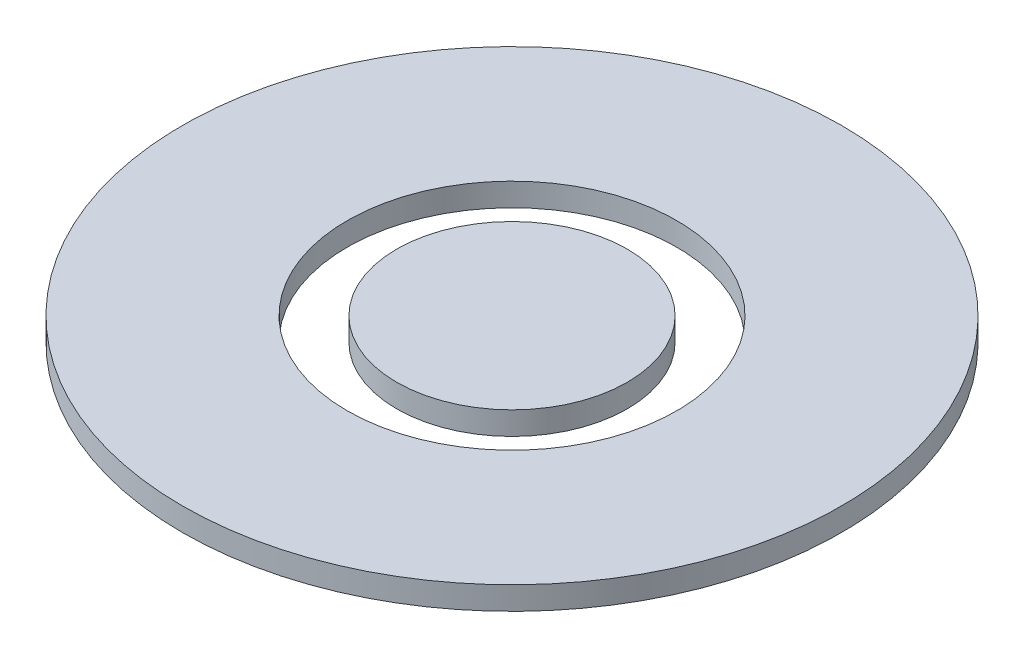
from build123d import *

# Parameters (mm, degrees)
SKETCH1_R           = 10
SKETCH1_R_2         = 5
BOSS_EXTRUDE1_DEPTH = 0.7
SKETCH2_R           = 3.5
BOSS_EXTRUDE2_DEPTH = 0.7


with BuildPart() as part:
    # Sketch1 → Boss-Extrude1 (new body)
    with BuildSketch(Plane(origin=(0, 0, 0), x_dir=(1, 0, 0), z_dir=(0, 1, 0))):
        with Locations(Location((0, 0, 0), (0, 0, 270))):
            Circle(SKETCH1_R)
        with Locations(Location((0, 0, 0), (0, 0, 270))):
            Circle(SKETCH1_R_2, mode=Mode.SUBTRACT)
    extrude(amount=BOSS_EXTRUDE1_DEPTH)


with BuildPart() as body_2:
    # Sketch2 → Boss-Extrude2 (new body)
    with BuildSketch(Plane(origin=(0, 0, 0), x_dir=(1, 0, 0), z_dir=(0, 1, 0))):
        with Locations(Location((0, 0, 0), (0, 0, 270))):
            Circle(SKETCH2_R)
    extrude(amount=BOSS_EXTRUDE2_DEPTH)


solid = Compound([part.part, body_2.part])
